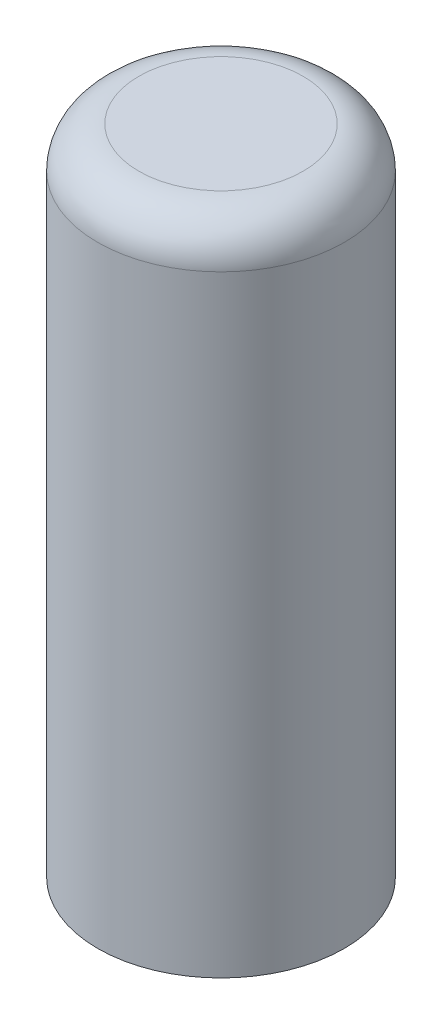
from build123d import *

# Parameters (mm, degrees)
SKETCH1_R           = 1.5
BOSS_EXTRUDE1_DEPTH = 7.9375
FILLET1_R           = 0.5


with BuildPart() as part:
    # Sketch1 → Boss-Extrude1 (new body)
    with BuildSketch(Plane(origin=(0, 0, 0), x_dir=(1, 0, 0), z_dir=(0, 1, 0))):
        with Locations(Location((0, 0, 0), (0, 0, 270))):
            Circle(SKETCH1_R)
    extrude(amount=BOSS_EXTRUDE1_DEPTH)

    # Fillet1
    fillet1_edges = [part.edges().sort_by_distance(p)[0] for p in [
        (0, 7.9375, -1.5),
    ]]
    fillet(fillet1_edges, radius=FILLET1_R)


solid = part.part
